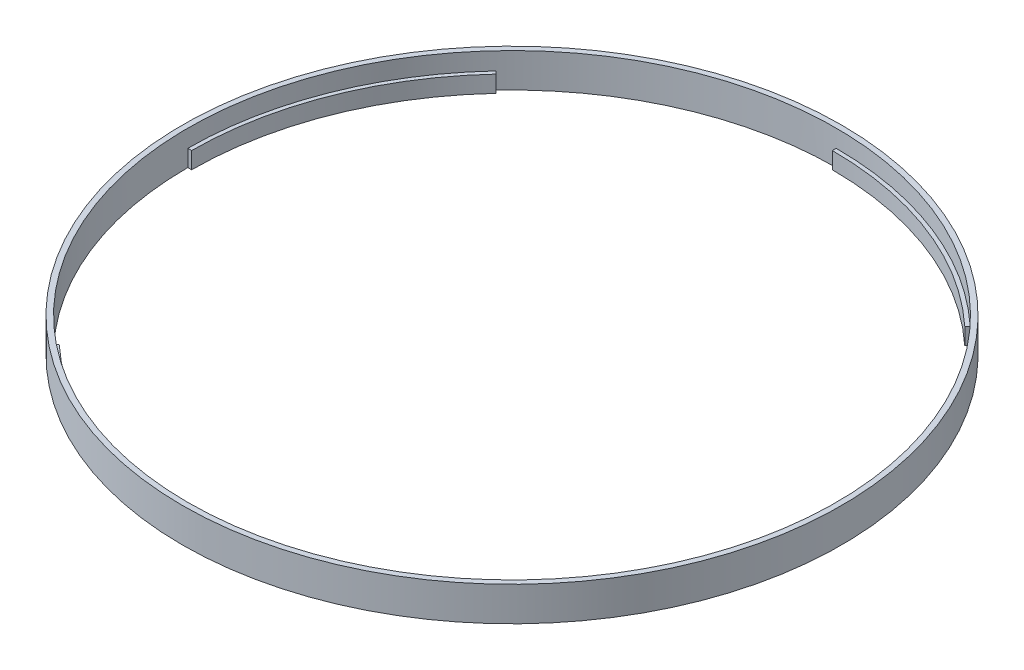
from build123d import *

# Parameters (mm, degrees)
SKETCH_1_R      = 77
SKETCH_1_R_2    = 75.75
EXTRUDE_1_DEPTH = 8
EXTRUDE_2_DEPTH = 3.9


with BuildPart() as part:
    # 草图1 → 凸台-拉伸1 (new body)
    with BuildSketch(Plane(origin=(0, 0, 0), x_dir=(1, 0, 0), z_dir=(0, 1, 0))):
        with Locations(Location((0, 0, 0), (0, 0, 270))):
            Circle(SKETCH_1_R)
        with Locations(Location((0, 0, 0), (0, 0, 270))):
            Circle(SKETCH_1_R_2, mode=Mode.SUBTRACT)
    extrude(amount=EXTRUDE_1_DEPTH)

    # 草图2 → 凸台-拉伸2 (add)
    with BuildSketch(Plane(origin=(0, 0, 0), x_dir=(1, 0, 0), z_dir=(0, 1, 0))):
        with BuildLine():
            Line((0, 75.75), (0, 74.85))
            ThreePointArc((0, 74.85), (27.43261682, 69.641754963), (51.047577251, 54.741824566))
            Line((51.047577251, 54.741824566), (51.661375775, 55.400042898))
            ThreePointArc((51.661375775, 55.400042898), (27.762467924, 70.479130775), (0, 75.75))
        make_face()
        with BuildLine():
            Line((55.400042898, -51.661375775), (54.741824566, -51.047577251))
            ThreePointArc((54.741824566, -51.047577251), (69.641754963, -27.43261682), (74.85, 0))
            Line((74.85, 0), (75.75, 0))
            ThreePointArc((75.75, 0), (70.479130775, -27.762467924), (55.400042898, -51.661375775))
        make_face()
        with BuildLine():
            Line((-51.661375775, -55.400042898), (-51.047577251, -54.741824566))
            ThreePointArc((-51.047577251, -54.741824566), (-27.43261682, -69.641754963), (0, -74.85))
            Line((0, -74.85), (0, -75.75))
            ThreePointArc((0, -75.75), (-27.762467924, -70.479130775), (-51.661375775, -55.400042898))
        make_face()
        with BuildLine():
            Line((-55.400042898, 51.661375775), (-54.741824566, 51.047577251))
            ThreePointArc((-54.741824566, 51.047577251), (-69.641754963, 27.43261682), (-74.85, 0))
            Line((-74.85, 0), (-75.75, 0))
            ThreePointArc((-75.75, 0), (-70.479130775, 27.762467924), (-55.400042898, 51.661375775))
        make_face()
    extrude(amount=EXTRUDE_2_DEPTH)


solid = part.part
